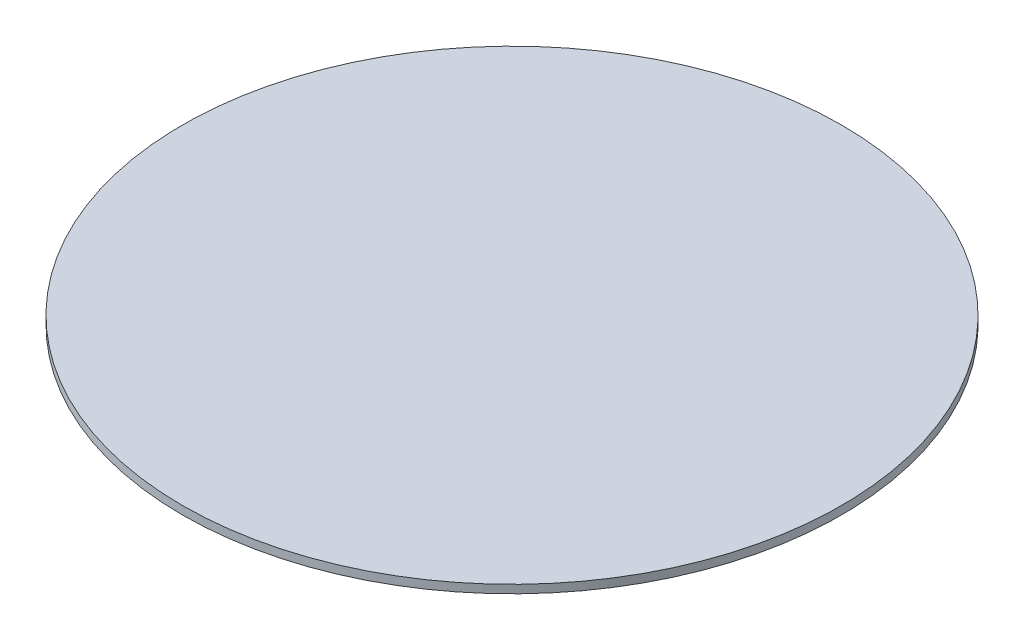
from build123d import *

# Parameters (mm, degrees)
SZKIC1_R                    = 12
DODANIE_WYCI_GNI_CIE1_DEPTH = 0.3


with BuildPart() as part:
    # Szkic1 → Dodanie-wyciągnięcie1 (new body)
    with BuildSketch(Plane(origin=(0, 0, 0), x_dir=(1, 0, 0), z_dir=(0, 1, 0))):
        with Locations(Location((0, 0, 0), (0, 0, 270))):
            Circle(SZKIC1_R)
    extrude(amount=DODANIE_WYCI_GNI_CIE1_DEPTH)


solid = part.part
